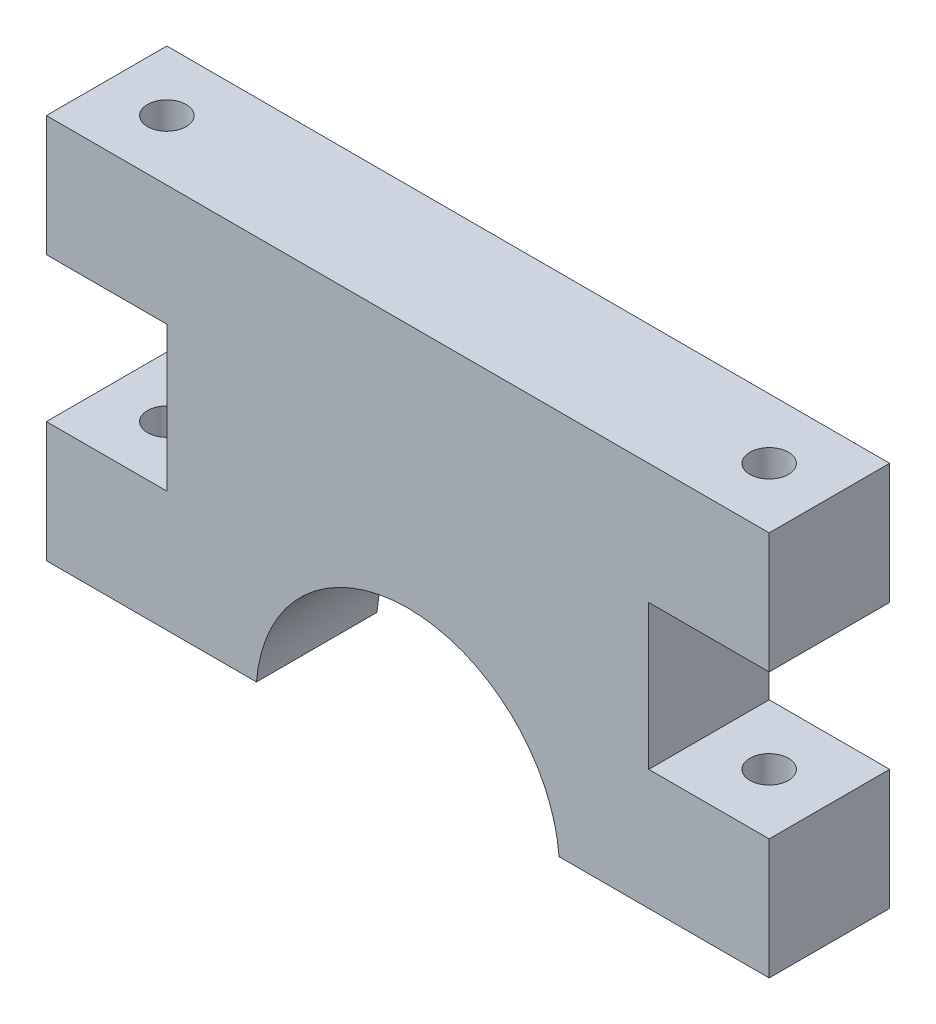
from build123d import *

# Parameters (mm, degrees)
SKETCH_1_W          = 10
SKETCH_1_H          = 10
EXTRUDE_1_DEPTH     = 10
SKETCH_3_R          = 1.6
CUT_EXTRUDE_1_DEPTH = 32


with BuildPart() as part:
    # Эскиз1 → Бобышка-Вытянуть1 (new body)
    with BuildSketch(Plane.XY):
        with Locations((-25, 11)):
            Rectangle(SKETCH_1_W, SKETCH_1_H)
        with BuildLine():
            ThreePointArc((12.560254774, -16), (0, -4.4), (-12.560254774, -16))
            Line((-12.560254774, -16), (-20, -16))
            Line((-20, -16), (-20, 16))
            Line((-20, 16), (20, 16))
            Line((20, 16), (20, -16))
            Line((20, -16), (12.560254774, -16))
        make_face()
        with Locations((-25, -11)):
            Rectangle(SKETCH_1_W, SKETCH_1_H)
        with Locations((25, 11)):
            Rectangle(SKETCH_1_W, SKETCH_1_H)
        with Locations((25, -11)):
            Rectangle(SKETCH_1_W, SKETCH_1_H)
    extrude(amount=EXTRUDE_1_DEPTH)

    # Эскиз3 → Вырез-Вытянуть1 (cut)
    with BuildSketch(Plane(origin=(0, 16, 0), x_dir=(1, 0, 0), z_dir=(0, 1, 0))):
        with Locations(Location((-25, -5, 0), (0, 0, 270))):
            Circle(SKETCH_3_R)
        with Locations(Location((25, -5, 0), (0, 0, 180))):
            Circle(SKETCH_3_R)
    extrude(amount=-CUT_EXTRUDE_1_DEPTH, mode=Mode.SUBTRACT)


solid = part.part
